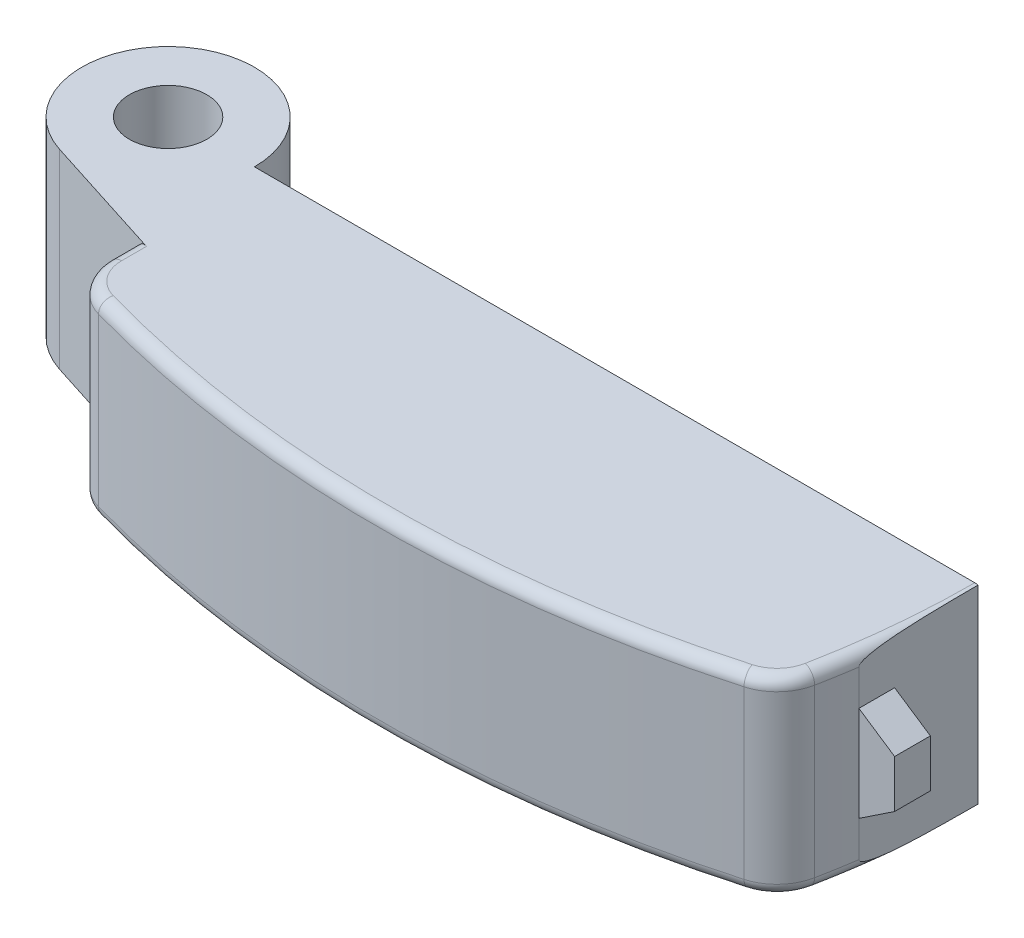
from build123d import *

# Parameters (mm, degrees)
SKETCH1_R           = 1.625
BOSS_EXTRUDE1_DEPTH = 4
BOSS_EXTRUDE2_DEPTH = 1.5
FILLET1_R           = 0.5
SKETCH4_W           = 4
SKETCH4_H           = 5
CUT_EXTRUDE1_DEPTH  = 4


with BuildPart() as part:
    # Sketch1 → Boss-Extrude1 (new, symmetric)
    with BuildSketch(Plane(origin=(0, 0, 0), x_dir=(1, 0, 0), z_dir=(0, 1, 0))):
        with BuildLine():
            Line((34, 0), (3.625, 0))
            ThreePointArc((3.625, 0), (-2.138914072, 2.926716862), (-1.100887775, -3.453790831))
            Line((-1.100887775, -3.453790831), (3.75, -5))
            Line((3.75, -5), (3.75, -6.203874108))
            ThreePointArc((3.75, -6.203874108), (4.15563796, -7.411354826), (5.208009684, -8.12903553))
            ThreePointArc((5.208009684, -8.12903553), (18.757767579, -10), (32.307525473, -8.12903553))
            ThreePointArc((32.307525473, -8.12903553), (33.236223507, -7.559261794), (33.728449863, -6.587235373))
            ThreePointArc((33.728449863, -6.587235373), (33.873522982, -5.795208431), (34, -5))
            Line((34, -5), (34, 0))
        make_face()
        Circle(SKETCH1_R, mode=Mode.SUBTRACT)
    extrude(amount=BOSS_EXTRUDE1_DEPTH, both=True)

    # Sketch3 → Boss-Extrude2 (add)
    with BuildSketch(Plane(origin=(0, 0, 5), x_dir=(-1, 0, 0), z_dir=(0, 0, -1))):
        Polygon((-34, -2), (-35.5, -1), (-35.5, 1), (-34, 2), align=None)
    extrude(amount=BOSS_EXTRUDE2_DEPTH)

    # Fillet1
    fillet1_edges = [part.edges().sort_by_distance(p)[0] for p in [
        (3.75, 4, 5.601937054),
        (4.15563796, 4, 7.411354826),
        (33.873522982, 4, 5.795208431),
        (33.236223507, 4, 7.559261794),
        (3.75, -4, 5.601937054),
        (4.15563796, -4, 7.411354826),
        (33.873522982, -4, 5.795208431),
        (33.236223507, -4, 7.559261794),
        (18.757767579, 4, 10),
        (18.757767579, -4, 10),
    ]]
    fillet(fillet1_edges, radius=FILLET1_R)

    # Sketch4 → Cut-Extrude1 (cut)
    with BuildSketch(Plane(origin=(0, 0, 0), x_dir=(-1, 0, 0), z_dir=(0, 0, -1))):
        with Locations((-30, 0)):
            Rectangle(SKETCH4_W, SKETCH4_H)
    extrude(amount=-CUT_EXTRUDE1_DEPTH, mode=Mode.SUBTRACT)


solid = part.part
